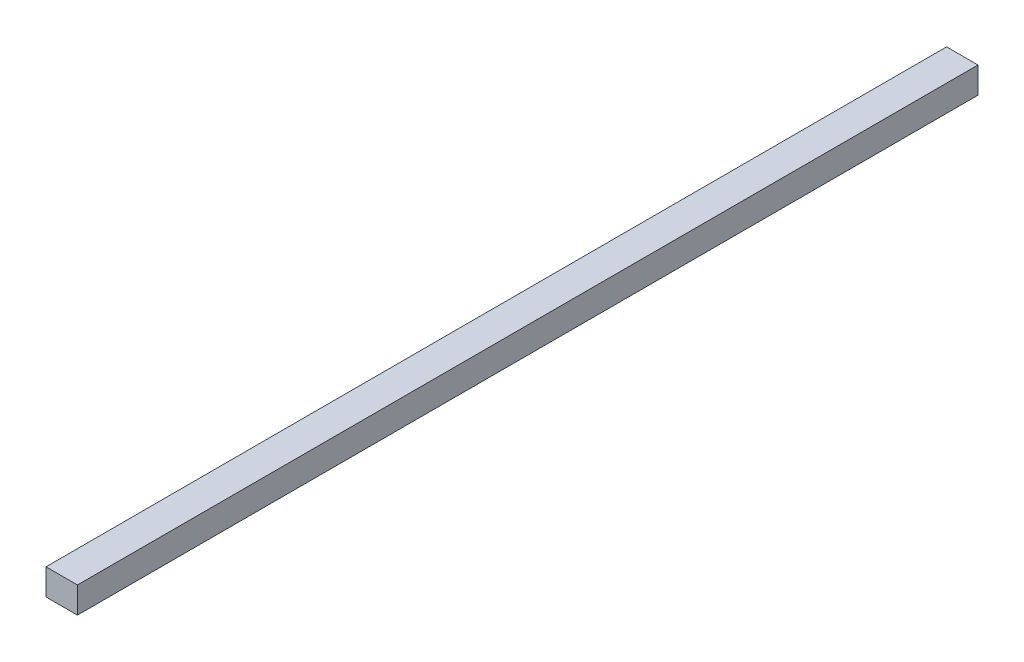
from build123d import *

# Parameters (mm, degrees)
SKETCH_1_W      = 12
SKETCH_1_H      = 10
EXTRUDE_1_DEPTH = 344


with BuildPart() as part:
    # Эскиз1 → Бобышка-Вытянуть1 (new body)
    with BuildSketch(Plane.XY):
        with Locations((6, 5)):
            Rectangle(SKETCH_1_W, SKETCH_1_H)
    extrude(amount=EXTRUDE_1_DEPTH)


solid = part.part
